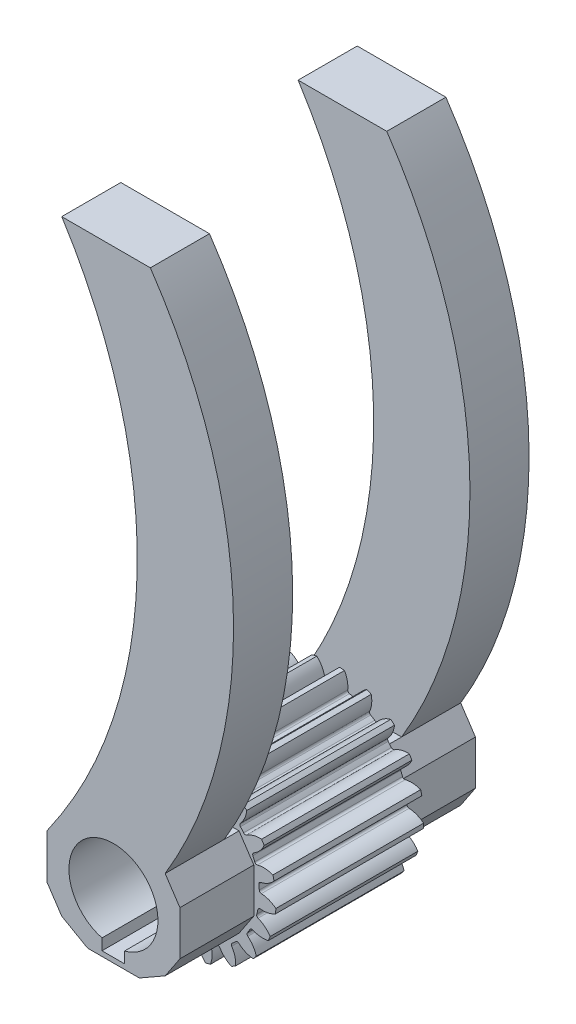
from build123d import *

# Parameters (mm, degrees)
CROQUIS1_R              = 12
SALIENTE_EXTRUIR1_DEPTH = 20
CORTAR_EXTRUIR1_DEPTH   = 27.229754097
MATRIZC2_COUNT          = 20
SALIENTE_EXTRUIR2_DEPTH = 20
SALIENTE_EXTRUIR3_DEPTH = 8
CORTAR_EXTRUIR2_DEPTH   = 88.409164199


with BuildPart() as part:
    # Croquis1 → Saliente-Extruir1 (new body)
    with BuildSketch(Plane.XY):
        Circle(CROQUIS1_R)
    extrude(amount=SALIENTE_EXTRUIR1_DEPTH)

    # Croquis2 → Cortar-Extruir1 (cut, through all)
    with BuildSketch(Plane.XY.offset(20)):
        with BuildLine():
            ThreePointArc((0.609300966, 11.984521364), (-0.941872727, 11.962979385), (-2.477305347, 11.74150579))
            ThreePointArc((-2.477305347, 11.74150579), (-1.805576465, 10.915471497), (-1.420398685, 9.922903906))
            ThreePointArc((-1.420398685, 9.922903906), (-1.302095185, 9.742812878), (-1.093586164, 9.688476108))
            ThreePointArc((-1.093586164, 9.688476108), (-0.765271591, 9.71992075), (-0.436081324, 9.740242968))
            ThreePointArc((-0.436081324, 9.740242968), (-0.238644783, 9.82654076), (-0.149982176, 10.022926704))
            ThreePointArc((-0.149982176, 10.022926704), (0.075118394, 11.063542904), (0.609300966, 11.984521364))
        make_face()
    cortar_extruir1 = extrude(amount=-CORTAR_EXTRUIR1_DEPTH, mode=Mode.SUBTRACT)

    # MatrizC2: Cortar-Extruir1 ×20 about axis
    matrizc2_axis = Axis((0, 0, 0), (0, 0, 1))
    for i in range(1, MATRIZC2_COUNT):
        add(cortar_extruir1.rotate(matrizc2_axis, i * 360 / MATRIZC2_COUNT), mode=Mode.SUBTRACT)

    # Croquis4 → Saliente-Extruir2 (add, symmetric)
    with BuildSketch(Plane.XY.offset(10)):
        Polygon((-7, -6), (-3.5, -8), (3.5, -8), (7, -6), (9, -3), (9, 3), (7, 6), (-7, 6), (-9, 3), (-9, -3), align=None)
    extrude(amount=SALIENTE_EXTRUIR2_DEPTH, both=True)

    # Croquis6 → Saliente-Extruir3 (add)
    with BuildSketch(Plane.XY.offset(30)):
        with BuildLine():
            Line((-7, 76), (5, 76))
            ThreePointArc((5, 76), (16.23269796, 41.292362799), (7, 6))
            Line((7, 6), (-7, 6))
            ThreePointArc((-7, 6), (3.227744249, 41), (-7, 76))
        make_face()
    saliente_extruir3 = extrude(amount=-SALIENTE_EXTRUIR3_DEPTH)

    # Simetría1: Saliente-Extruir3 across plane
    add(saliente_extruir3.mirror(Plane.XY.offset(10)))

    # Croquis7 → Cortar-Extruir2 (cut, through all)
    with BuildSketch(Plane.XY.offset(30)):
        with BuildLine():
            Line((1.5, -5.835291338), (1.5, -7.335291338))
            Line((1.5, -7.335291338), (-1.55, -7.335291338))
            Line((-1.55, -7.335291338), (-1.55, -5.822209632))
            ThreePointArc((-1.55, -5.822209632), (0.025841493, 6.024944582), (1.5, -5.835291338))
        make_face()
    extrude(amount=-CORTAR_EXTRUIR2_DEPTH, mode=Mode.SUBTRACT)


solid = part.part
